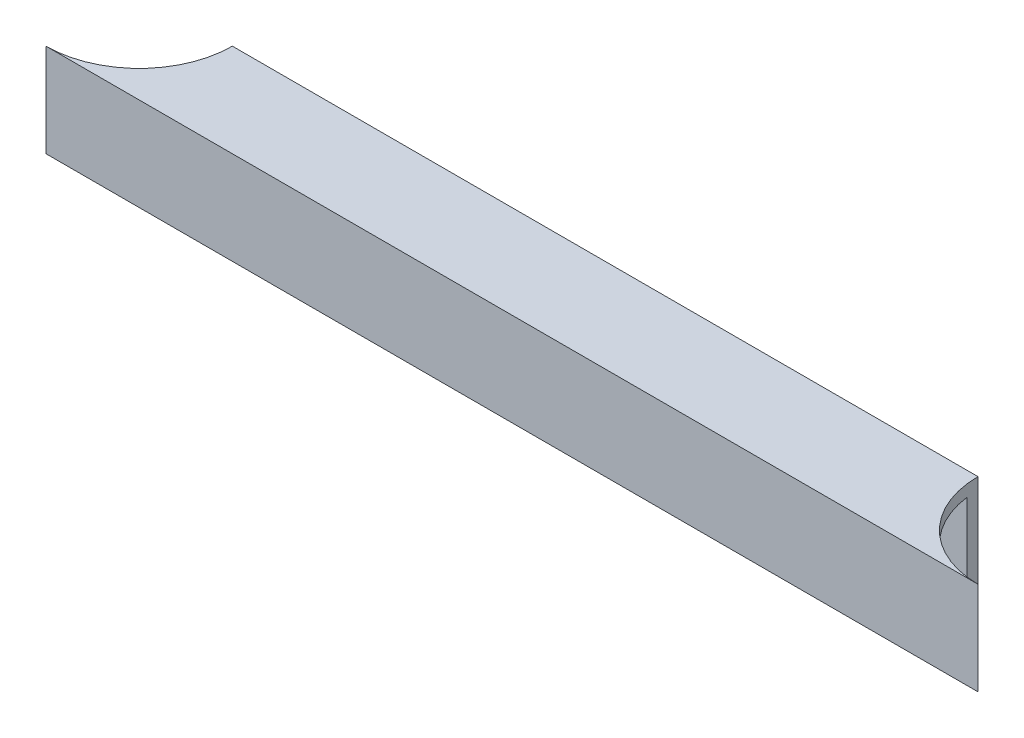
from build123d import *

# Parameters (mm, degrees)
BOSS_EXTRUDE1_DEPTH     = 25.4
CUT_EXTRUDE1_DEPTH      = 163.851117067
CUT_EXTRUDE1_DEPTH_BACK = 163.851117067
SKETCH2_W               = 19.05
SKETCH2_H               = 19.05


with BuildPart() as part:
    # Sketch1 → Boss-Extrude1 (new body)
    with BuildSketch(Plane(origin=(0, 0, 0), x_dir=(1, 0, 0), z_dir=(0, 1, 0))):
        with BuildLine():
            Line((-127, -98.723484187), (127, -98.723484187))
            ThreePointArc((127, -98.723484187), (109.039487758, -91.283996429), (101.6, -73.323484187))
            Line((101.6, -73.323484187), (-101.6, -73.323484187))
            ThreePointArc((-101.6, -73.323484187), (-109.039487758, -91.283996429), (-127, -98.723484187))
        make_face()
    extrude(amount=BOSS_EXTRUDE1_DEPTH)

    # Sketch2 → Cut-Extrude1 (cut, two sides: drawn at the far end of the back side and taken through both)
    with BuildSketch(Plane(origin=(0, 0, 0), x_dir=(0, 0, -1), z_dir=(1, 0, 0)).offset(-CUT_EXTRUDE1_DEPTH_BACK)):
        with Locations((-86.023484187, 12.7)):
            Rectangle(SKETCH2_W, SKETCH2_H)
    extrude(amount=CUT_EXTRUDE1_DEPTH + CUT_EXTRUDE1_DEPTH_BACK, mode=Mode.SUBTRACT)


solid = part.part
